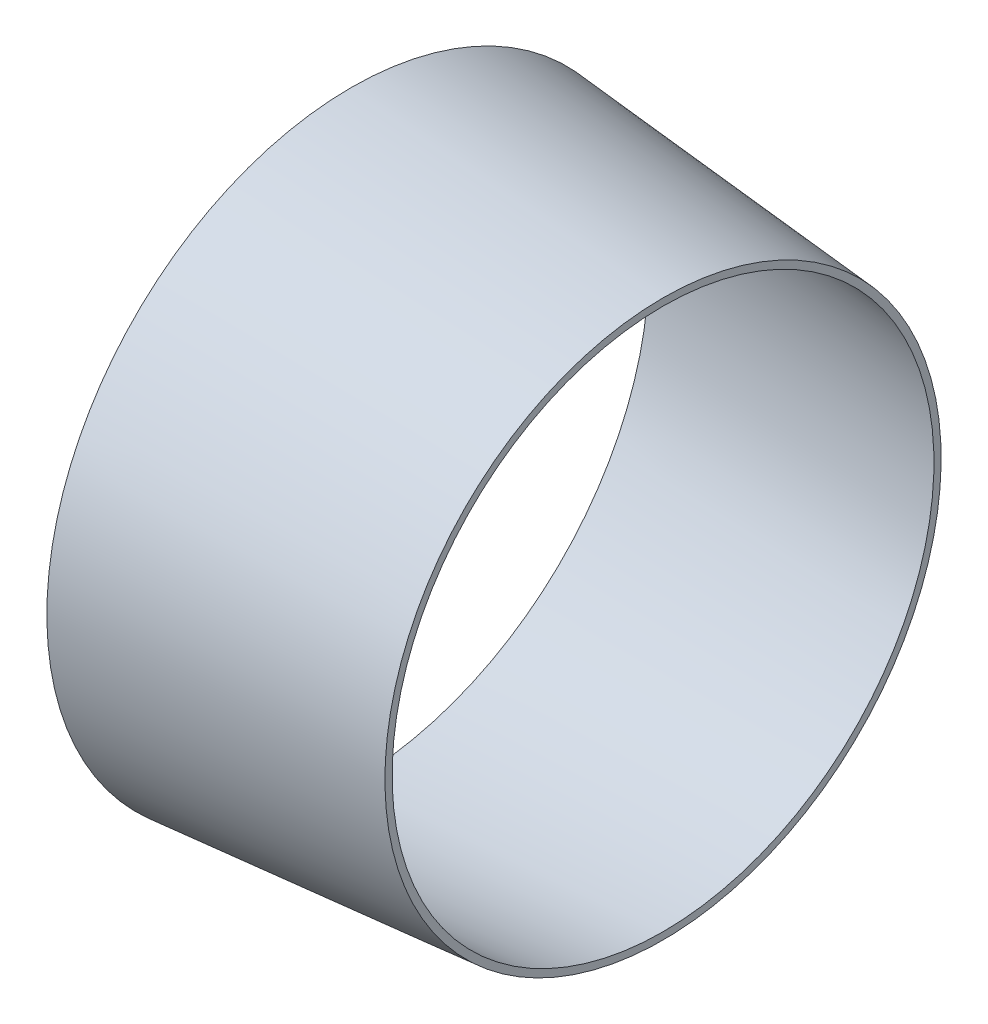
from build123d import *

# Parameters (mm, degrees)
REVOLVE1_ANGLE = 359.999999589


with BuildPart() as part:
    # Sketch1 → Revolve1 (revolve)
    with BuildSketch(Plane.XY):
        Polygon((3700, 620), (3700, 635), (4350, 580), (4350, 565), align=None)
    revolve(axis=Axis((0, 0, 0), (1, 0, 0)), revolution_arc=REVOLVE1_ANGLE)


solid = part.part
